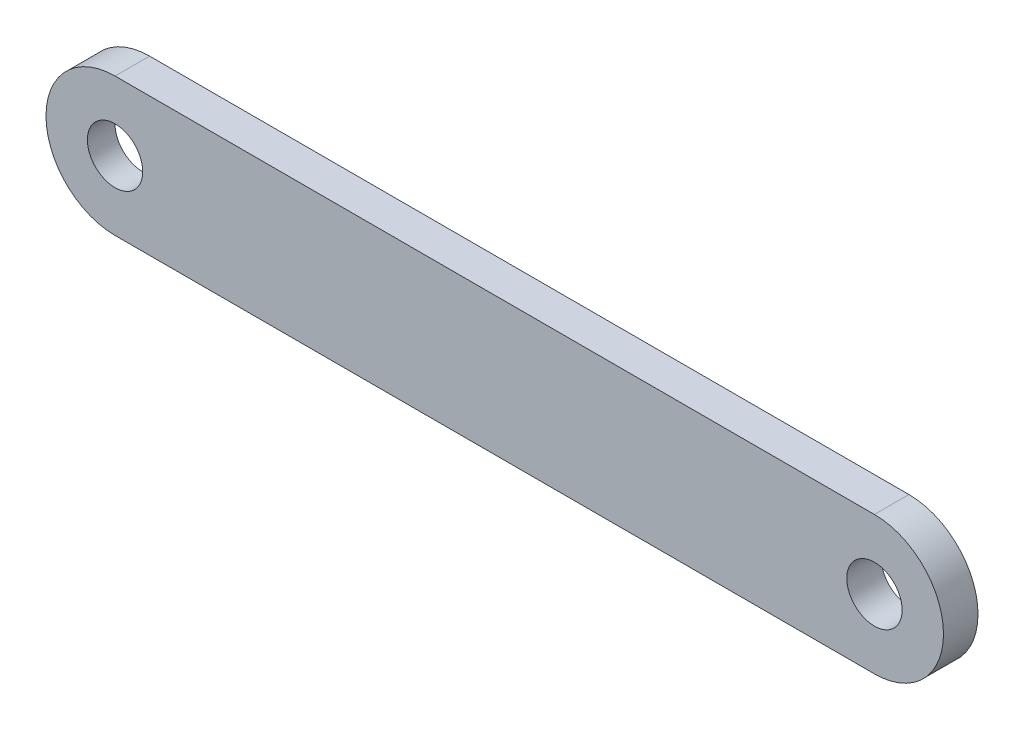
from build123d import *

# Parameters (mm, degrees)
SKETCH1_R           = 4.01
BOSS_EXTRUDE1_DEPTH = 5
SKETCH2_R           = 1.49
BOSS_EXTRUDE3_DEPTH = 4
SKETCH5_W           = 12.1
SKETCH5_H           = 10.1
CUT_EXTRUDE1_DEPTH  = 1


with BuildPart() as part:
    # Sketch1 → Boss-Extrude1 (new body)
    with BuildSketch(Plane.XY):
        with BuildLine():
            Line((110, 10), (0, 10))
            ThreePointArc((0, 10), (-10, 0), (0, -10))
            Line((0, -10), (110, -10))
            ThreePointArc((110, -10), (120, 0), (110, 10))
        make_face()
        Circle(SKETCH1_R, mode=Mode.SUBTRACT)
        with Locations((110, 0)):
            Circle(SKETCH1_R, mode=Mode.SUBTRACT)
    extrude(amount=BOSS_EXTRUDE1_DEPTH)

    # Sketch2 → Boss-Extrude3 (add)
    with BuildSketch(Plane(origin=(0, 0, 0), x_dir=(-1, 0, 0), z_dir=(0, 0, -1))):
        with Locations(Location((-20, 0, 0), (0, 0, 180))):
            Circle(SKETCH2_R)
    extrude(amount=BOSS_EXTRUDE3_DEPTH)

    # Sketch5 → Cut-Extrude1 (cut)
    with BuildSketch(Plane(origin=(0, 0, 0), x_dir=(-1, 0, 0), z_dir=(0, 0, -1))):
        Rectangle(SKETCH5_W, SKETCH5_H)
    extrude(amount=-CUT_EXTRUDE1_DEPTH, mode=Mode.SUBTRACT)


solid = part.part
